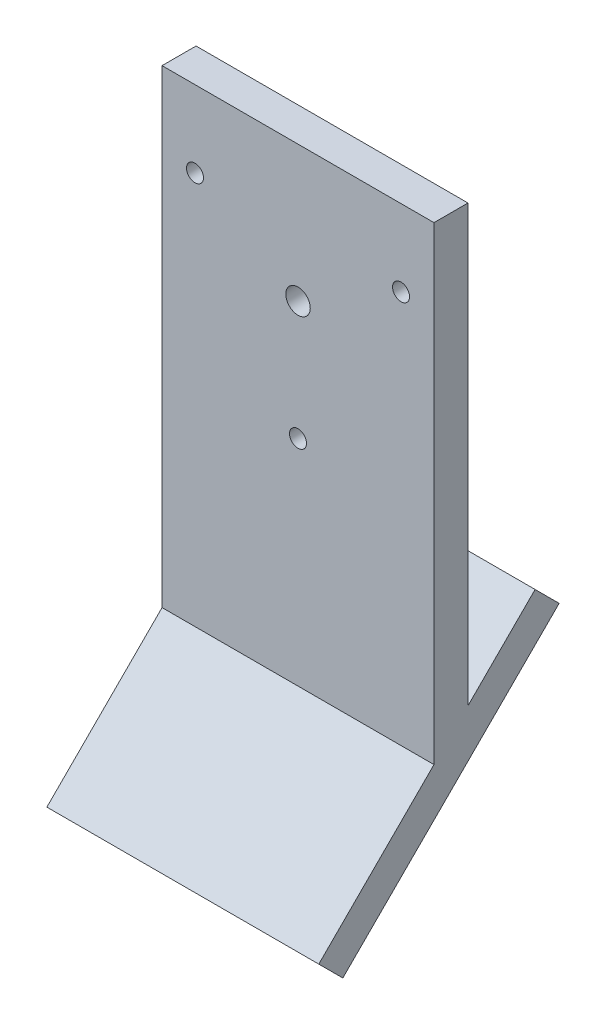
from build123d import *

# Parameters (mm, degrees)
BOSS_EXTRUDE1_DEPTH   = 20
M3X0_5_TAPPED_HOLE1_D = 2.5
M3_CLEARANCE_HOLE1_D  = 3.6


with BuildPart() as part:
    # Sketch1 → Boss-Extrude1 (new, symmetric)
    with BuildSketch(Plane(origin=(0, 0, 0), x_dir=(0, 0, -1), z_dir=(1, 0, 0))):
        Polygon((-15.909902577, -15.909902577), (15.909902577, 15.909902577), (12.374368671, 19.445436483), (2.5, 9.571067812), (2.5, 73.613363655), (-2.5, 73.613363655), (-2.5, 4.571067812), (-19.445436483, -12.374368671), align=None)
    extrude(amount=BOSS_EXTRUDE1_DEPTH, both=True)

    # M3x0.5 Tapped Hole1 (through all)
    with Locations(Plane.XY.offset(2.5)):
        with Locations((-15.155444566, 62.363363655), (15.155444566, 62.363363655), (0, 36.113363655)):
            Hole(M3X0_5_TAPPED_HOLE1_D / 2)

    # M3 Clearance Hole1 (through all)
    with Locations(Plane.XY.offset(2.5)):
        with Locations((0, 53.613363655)):
            Hole(M3_CLEARANCE_HOLE1_D / 2)


solid = part.part
